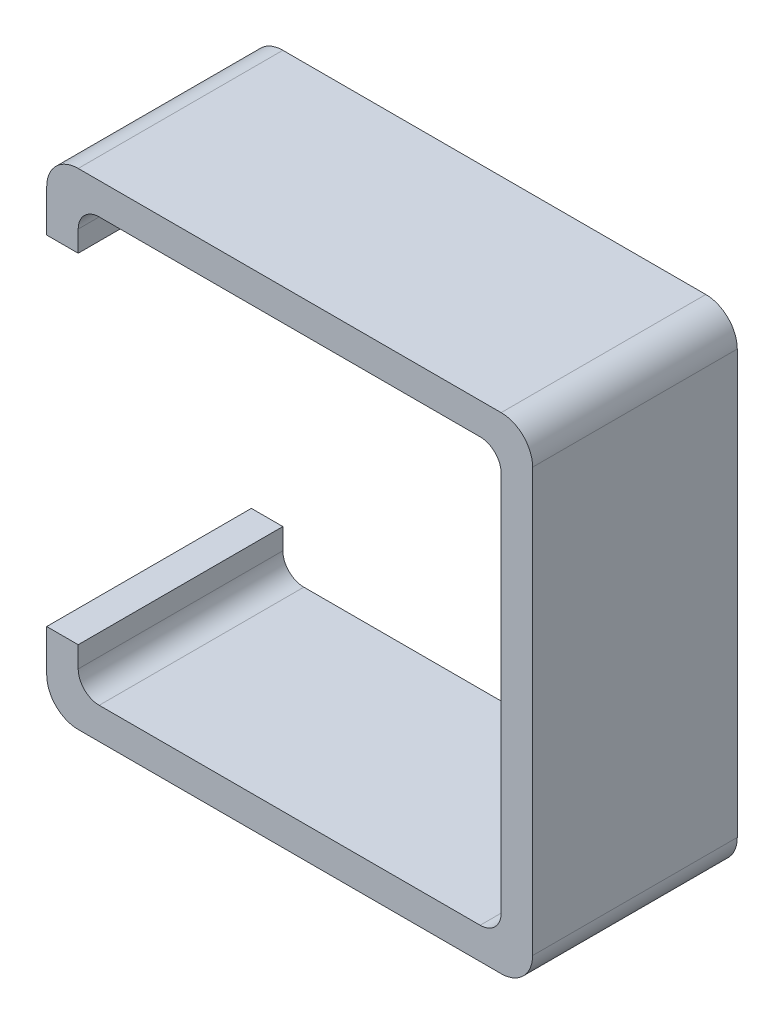
from build123d import *

# Parameters (mm, degrees)
BOSS_EXTRUDE1_DEPTH = 19.5


with BuildPart() as part:
    # Sketch1 → Boss-Extrude1 (new body)
    with BuildSketch(Plane(origin=(0, 0, 0), x_dir=(0, 1, 0), z_dir=(0, 0, 1))):
        with BuildLine():
            Line((8.15, 18.15), (8.15, 20.15))
            ThreePointArc((8.15, 20.15), (7.271320344, 22.271320344), (5.15, 23.15))
            Line((5.15, 23.15), (1.15, 23.15))
            Line((1.15, 23.15), (1.15, 20.15))
            Line((1.15, 20.15), (3.15, 20.15))
            ThreePointArc((3.15, 20.15), (4.564213562, 19.564213562), (5.15, 18.15))
            Line((5.15, 18.15), (5.15, -18.15))
            ThreePointArc((5.15, -18.15), (4.564213562, -19.564213562), (3.15, -20.15))
            Line((3.15, -20.15), (-33.15, -20.15))
            ThreePointArc((-33.15, -20.15), (-34.564213562, -19.564213562), (-35.15, -18.15))
            Line((-35.15, -18.15), (-35.15, 18.15))
            ThreePointArc((-35.15, 18.15), (-34.564213562, 19.564213562), (-33.15, 20.15))
            Line((-33.15, 20.15), (-31.15, 20.15))
            Line((-31.15, 20.15), (-31.15, 23.15))
            Line((-31.15, 23.15), (-35.15, 23.15))
            ThreePointArc((-35.15, 23.15), (-37.271320344, 22.271320344), (-38.15, 20.15))
            Line((-38.15, 20.15), (-38.15, -20.15))
            ThreePointArc((-38.15, -20.15), (-37.271320344, -22.271320344), (-35.15, -23.15))
            Line((-35.15, -23.15), (5.15, -23.15))
            ThreePointArc((5.15, -23.15), (7.271320344, -22.271320344), (8.15, -20.15))
            Line((8.15, -20.15), (8.15, 18.15))
        make_face()
    extrude(amount=BOSS_EXTRUDE1_DEPTH)


solid = part.part
